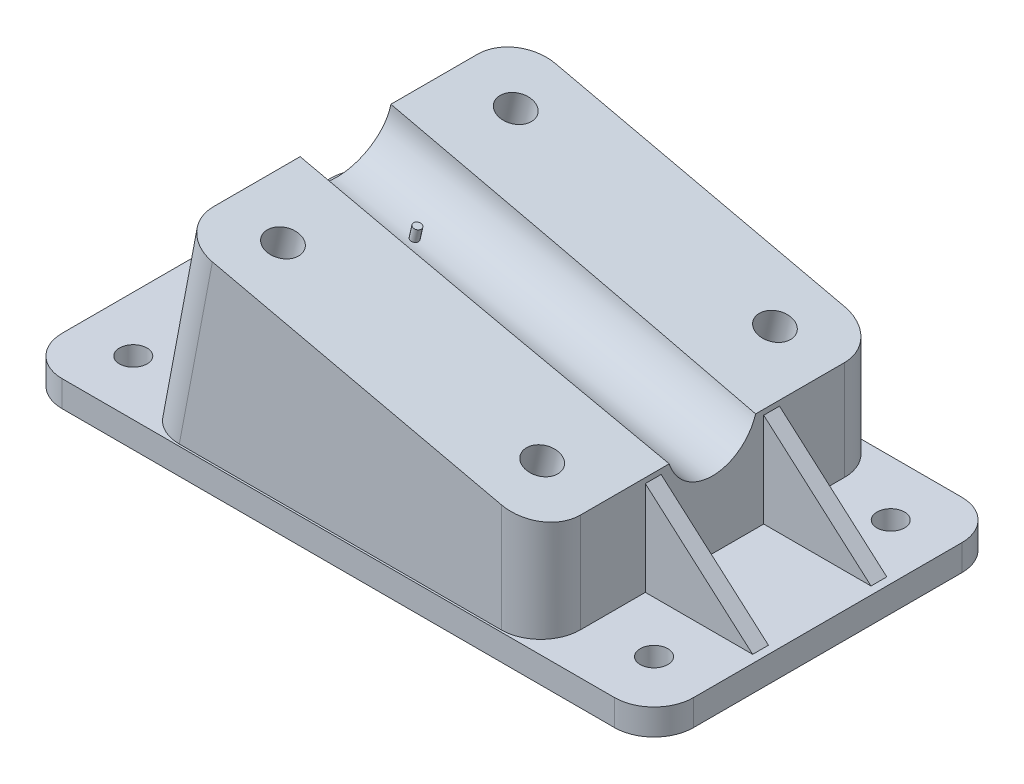
from build123d import *

# Parameters (mm, degrees)
SKETCH2_W               = 80
SKETCH2_H               = 44
BOSS_EXTRUDE1_DEPTH     = 3.3
FILLET1_R               = 5
SKETCH3_R               = 1.75
CUT_EXTRUDE1_DEPTH      = 46.76996832
MIRROR2_COPY_1_SKETCH_R = 1.75
MIRROR2_COPY_1_DEPTH    = 46.76996832
BOSS_EXTRUDE2_DEPTH     = 21.75
FILLET2_R               = 5
CUT_EXTRUDE2_DEPTH      = 73.174242058
BOSS_EXTRUDE3_START     = -5.75
SKETCH10_R              = 0.5
BOSS_EXTRUDE3_DEPTH     = 2
BOSS_EXTRUDE4_DEPTH     = 1
BOSS_EXTRUDE5_DEPTH     = 1
SKETCH15_R              = 2.032
CUT_EXTRUDE3_DEPTH      = 7.5


with BuildPart() as part:
    # Sketch2 → Boss-Extrude1 (new body)
    with BuildSketch(Plane(origin=(0, 0, 0), x_dir=(1, 0, 0), z_dir=(0, 1, 0))):
        Rectangle(SKETCH2_W, SKETCH2_H)
    extrude(amount=BOSS_EXTRUDE1_DEPTH)

    # Fillet1
    fillet1_edges = [part.edges().sort_by_distance(p)[0] for p in [
        (40, 1.65, 22),
        (-40, 1.65, 22),
        (-40, 1.65, -22),
        (40, 1.65, -22),
    ]]
    fillet(fillet1_edges, radius=FILLET1_R)

    # Sketch3 → Cut-Extrude1 (cut, through all)
    with BuildSketch(Plane(origin=(0, 3.3, 0), x_dir=(1, 0, 0), z_dir=(0, 1, 0))):
        with Locations(Location((33, -15, 0), (0, 0, 270))):
            Circle(SKETCH3_R)
    cut_extrude1 = extrude(amount=-CUT_EXTRUDE1_DEPTH, mode=Mode.SUBTRACT)

    # Mirror1: Cut-Extrude1 across plane
    add(cut_extrude1.mirror(Plane.XY), mode=Mode.SUBTRACT)

    # Mirror2: Cut-Extrude1 across plane
    add(cut_extrude1.mirror(Plane(origin=(0, 0, 0), x_dir=(0, 0, 1), z_dir=(1, 0, 0))), mode=Mode.SUBTRACT)

    # Mirror2 copy 1 sketch → Mirror2 copy 1 (cut, through all)
    with BuildSketch(Plane(origin=(0, 3.3, 0), x_dir=(-1, 0, 0), z_dir=(0, 1, 0))):
        with Locations(Location((33, -15, 0), (0, 0, 270))):
            Circle(MIRROR2_COPY_1_SKETCH_R)
    extrude(amount=-MIRROR2_COPY_1_DEPTH, mode=Mode.SUBTRACT)

    # Sketch4 → Boss-Extrude2 (add, symmetric)
    with BuildSketch(Plane.XY):
        Polygon((-25.5, 3.3), (-21.1, 26.5), (25.4, 15.9), (25.4, 3.3), align=None)
    extrude(amount=BOSS_EXTRUDE2_DEPTH, both=True)

    # Fillet2
    fillet2_edges = [part.edges().sort_by_distance(p)[0] for p in [
        (25.4, 9.6, -21.75),
        (-23.3, 14.9, -21.75),
        (25.4, 9.6, 21.75),
        (-23.3, 14.9, 21.75),
    ]]
    fillet(fillet2_edges, radius=FILLET2_R)

    # Sketch9 → Cut-Extrude2 (cut, through all)
    with BuildSketch(Plane(origin=(-25.218766141, 4.78286944, 0), x_dir=(0, 0, 1), z_dir=(-0.9824865243069563, 0.18633365116166412, 0))):
        with BuildLine():
            Line((-5.75, 22.104252855), (5.75, 22.104252855))
            ThreePointArc((5.75, 22.104252855), (0, 16.354252855), (-5.75, 22.104252855))
        make_face()
    extrude(amount=-CUT_EXTRUDE2_DEPTH, mode=Mode.SUBTRACT)

    # Sketch10 → Boss-Extrude3 (add)
    with BuildSketch(Plane(origin=(4.700170139, 20.618670893, 0), x_dir=(0.9749884721737534, -0.22225543666756517, 0), z_dir=(0.2222554366675652, 0.9749884721737535, 0)).offset(BOSS_EXTRUDE3_START)):
        with Locations((-16.262025835, 0)):
            Circle(SKETCH10_R)
    extrude(amount=BOSS_EXTRUDE3_DEPTH)

    # Sketch12 → Boss-Extrude4 (add, symmetric)
    with BuildSketch(Plane.XY):
        Polygon((-23.038031878, 16.281286463), (-38.252702488, 3.3), (-25.5, 3.3), align=None)
    extrude(amount=BOSS_EXTRUDE4_DEPTH, both=True)

    # Sketch14 → Boss-Extrude5 (add, symmetric)
    with BuildSketch(Plane.XY.offset(7.5)):
        Polygon((25.4, 15.243617542), (39, 3.3), (25.4, 3.3), align=None)
    boss_extrude5 = extrude(amount=BOSS_EXTRUDE5_DEPTH, both=True)

    # Mirror3: Boss-Extrude5 across plane
    add(boss_extrude5.mirror(Plane.XY))

    # Sketch15 → Cut-Extrude3 (cut)
    with BuildSketch(Plane(origin=(4.700170139, 20.618670893, 0), x_dir=(0.9749884721737534, -0.22225543666756517, 0), z_dir=(0.2222554366675652, 0.9749884721737535, 0))):
        with Locations(Location((-19.462025835, 14.75, 0), (0, 0, 180))):
            Circle(SKETCH15_R)
        with Locations(Location((14.23084575, 14.75, 0), (0, 0, 180))):
            Circle(SKETCH15_R)
    cut_extrude3 = extrude(amount=-CUT_EXTRUDE3_DEPTH, mode=Mode.SUBTRACT)

    # Mirror4: Cut-Extrude3 across plane
    add(cut_extrude3.mirror(Plane.XY), mode=Mode.SUBTRACT)


solid = part.part
